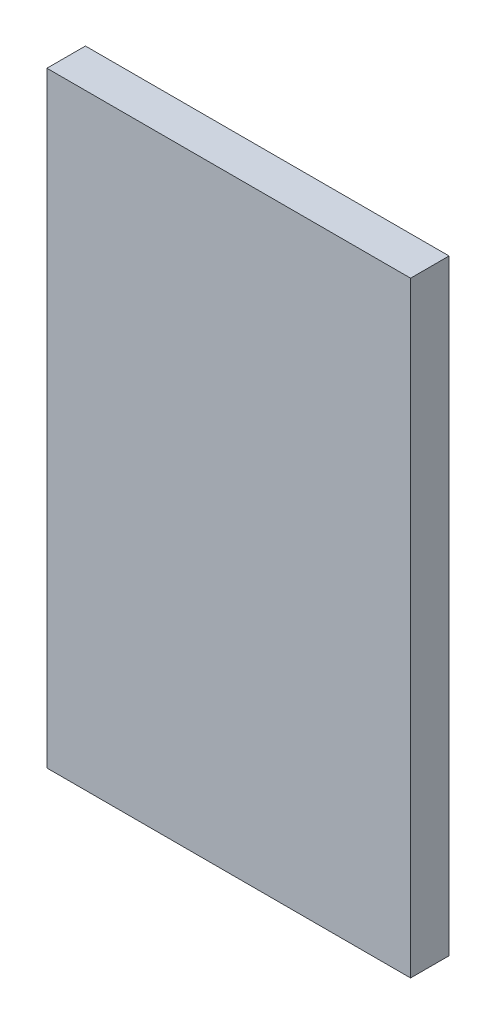
from build123d import *

# Parameters (mm, degrees)
SKETCH1_W           = 60
SKETCH1_H           = 100
BOSS_EXTRUDE1_DEPTH = 6.35


with BuildPart() as part:
    # Sketch1 → Boss-Extrude1 (new body)
    with BuildSketch(Plane.XY):
        with Locations((30, 50)):
            Rectangle(SKETCH1_W, SKETCH1_H)
    extrude(amount=BOSS_EXTRUDE1_DEPTH)


solid = part.part
